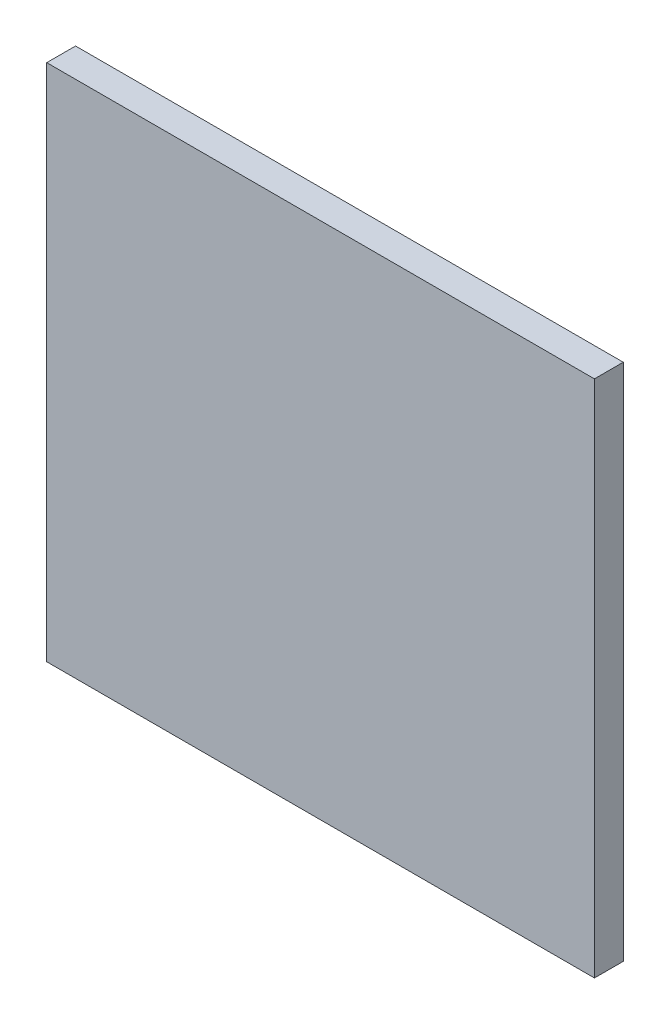
from build123d import *

# Parameters (mm, degrees)
SKETCH_1_W      = 3.8
SKETCH_1_H      = 3.6
EXTRUDE_1_DEPTH = 0.2
SKETCH_2_W      = 0.5
SKETCH_2_H      = 0.6
SKETCH_2_W_2    = 0.6
SKETCH_2_H_2    = 0.5
EXTRUDE_2_DEPTH = 0.006


with BuildPart() as part:
    # Эскиз1 → Бобышка-Вытянуть1 (new body)
    with BuildSketch(Plane.XY):
        with Locations((1.9, -1.8)):
            Rectangle(SKETCH_1_W, SKETCH_1_H)
    extrude(amount=EXTRUDE_1_DEPTH)

    # Эскиз2 → Бобышка-Вытянуть2 (add)
    with BuildSketch(Plane(origin=(0, 0, 0), x_dir=(-1, 0, 0), z_dir=(0, 0, -1))):
        with Locations((-0.4, -1.8)):
            Rectangle(SKETCH_2_W, SKETCH_2_H)
        with Locations((-1.9, -3.25)):
            Rectangle(SKETCH_2_W_2, SKETCH_2_H_2)
        with Locations((-3.4, -3.25)):
            Rectangle(SKETCH_2_W_2, SKETCH_2_H_2)
        with Locations((-3.4, -0.35)):
            Rectangle(SKETCH_2_W_2, SKETCH_2_H_2)
        with Locations((-1.9, -0.35)):
            Rectangle(SKETCH_2_W_2, SKETCH_2_H_2)
        with Locations((-0.4, -3.25)):
            Rectangle(SKETCH_2_W_2, SKETCH_2_H_2)
        with Locations((-0.4, -0.35)):
            Rectangle(SKETCH_2_W_2, SKETCH_2_H_2)
    extrude(amount=EXTRUDE_2_DEPTH)


solid = part.part
